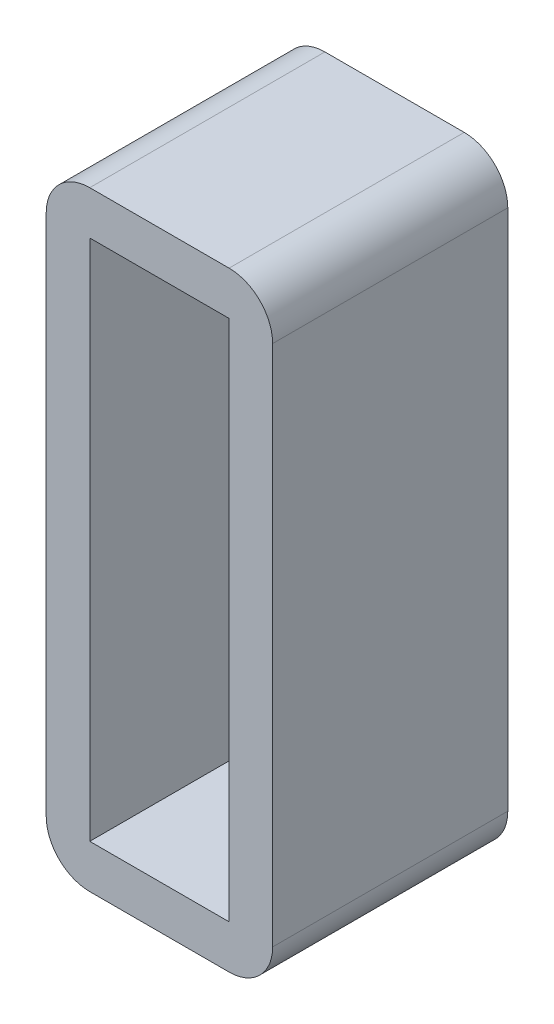
from build123d import *

# Parameters (mm, degrees)
SKETCH1_W           = 16
SKETCH1_H           = 60
BOSS_EXTRUDE1_DEPTH = 13.5


with BuildPart() as part:
    # Sketch1 → Boss-Extrude1 (new, symmetric)
    with BuildSketch(Plane.XY):
        with BuildLine():
            Line((-8, 35), (8, 35))
            ThreePointArc((8, 35), (11.535533906, 33.535533906), (13, 30))
            Line((13, 30), (13, -30))
            ThreePointArc((13, -30), (11.535533906, -33.535533906), (8, -35))
            Line((8, -35), (-8, -35))
            ThreePointArc((-8, -35), (-11.535533906, -33.535533906), (-13, -30))
            Line((-13, -30), (-13, 30))
            ThreePointArc((-13, 30), (-11.535533906, 33.535533906), (-8, 35))
        make_face()
        Rectangle(SKETCH1_W, SKETCH1_H, mode=Mode.SUBTRACT)
    extrude(amount=BOSS_EXTRUDE1_DEPTH, both=True)


solid = part.part
